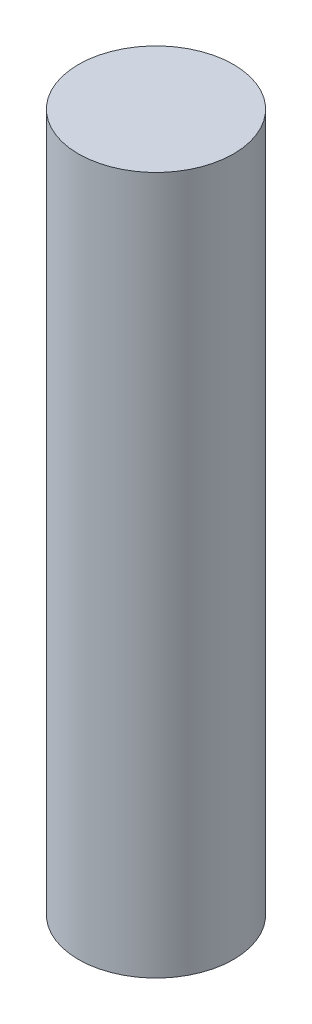
from build123d import *

# Parameters (mm, degrees)
SKETCH1_R           = 3.175
BOSS_EXTRUDE1_DEPTH = 28.575


with BuildPart() as part:
    # Sketch1 → Boss-Extrude1 (new body)
    with BuildSketch(Plane(origin=(0, 0, 0), x_dir=(1, 0, 0), z_dir=(0, 1, 0))):
        with Locations(Location((0, 0, 0), (0, 0, 270))):
            Circle(SKETCH1_R)
    extrude(amount=BOSS_EXTRUDE1_DEPTH)


solid = part.part
